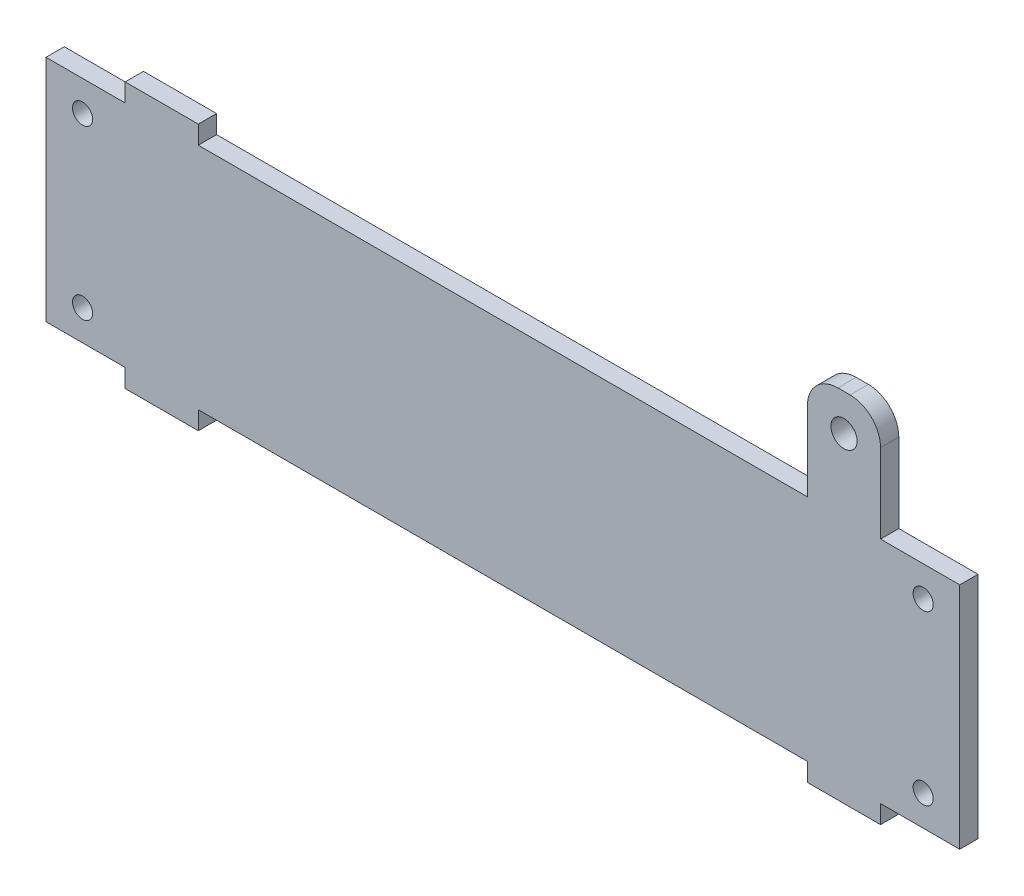
from build123d import *

# Parameters (mm, degrees)
SKETCH_1_R      = 2.15
SKETCH_1_R_2    = 1.65
EXTRUDE_1_DEPTH = 3
FILLET_1_R      = 5


with BuildPart() as part:
    # 草图1 → 凸台-拉伸1 (new body)
    with BuildSketch(Plane.XY):
        Polygon((0, 0), (13, 0), (13, -3), (25, -3), (25, 0), (125, 0), (125, -3), (137, -3), (137, 0), (150, 0), (150, 37.6), (137, 37.6), (137, 40.6), (137, 55.6), (125, 55.6), (125, 40.6), (125, 37.6), (25, 37.6), (25, 40.6), (13, 40.6), (13, 37.6), (0, 37.6), align=None)
        with Locations((131, 49.6)):
            Circle(SKETCH_1_R, mode=Mode.SUBTRACT)
        with Locations((6, 32.6)):
            Circle(SKETCH_1_R_2, mode=Mode.SUBTRACT)
        with Locations((6, 5)):
            Circle(SKETCH_1_R_2, mode=Mode.SUBTRACT)
        with Locations(Location((144, 32.6, 0), (0, 0, 180))):
            Circle(SKETCH_1_R_2, mode=Mode.SUBTRACT)
        with Locations(Location((144, 5, 0), (0, 0, 180))):
            Circle(SKETCH_1_R_2, mode=Mode.SUBTRACT)
    extrude(amount=EXTRUDE_1_DEPTH)

    # 圆角1
    fillet_1_edges = [part.edges().sort_by_distance(p)[0] for p in [
        (125, 55.6, 1.5),
        (137, 55.6, 1.5),
    ]]
    fillet(fillet_1_edges, radius=FILLET_1_R)


solid = part.part
